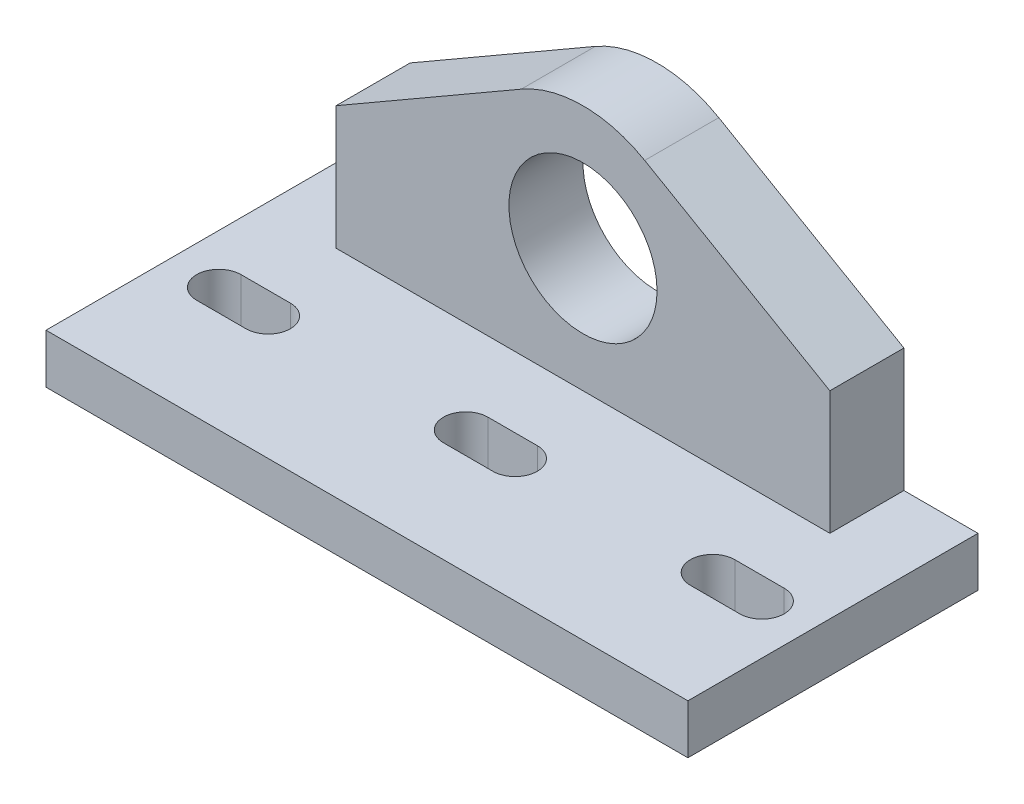
from build123d import *

# Parameters (mm, degrees)
SKETCH_2_W             = 260
SKETCH_2_H             = 117.5
EXTRUDE_1_DEPTH        = 20
CUT_EXTRUDE_1_DEPTH    = 287.017919019
PATTERN_LINEAR_1_COUNT = 3
PATTERN_LINEAR_1_PITCH = 100
SKETCH_4_W             = 200
SKETCH_4_H             = 30
EXTRUDE_2_DEPTH        = 100
SKETCH_5_R             = 30
CUT_EXTRUDE_2_DEPTH    = 300.42653523


with BuildPart() as part:
    # 草图2 → 凸台-拉伸1 (new body)
    with BuildSketch(Plane(origin=(0, 0, 0), x_dir=(1, 0, 0), z_dir=(0, 1, 0))):
        with Locations((130, -58.75)):
            Rectangle(SKETCH_2_W, SKETCH_2_H)
    extrude(amount=EXTRUDE_1_DEPTH)

    # 草图3 → 切除-拉伸1 (cut, through all)
    with BuildSketch(Plane(origin=(0, 20, 0), x_dir=(1, 0, 0), z_dir=(0, 1, 0))):
        with BuildLine():
            Line((20, -58.5), (40, -58.5))
            ThreePointArc((40, -58.5), (49, -67.5), (40, -76.5))
            Line((40, -76.5), (20, -76.5))
            ThreePointArc((20, -76.5), (11, -67.5), (20, -58.5))
        make_face()
    cut_extrude_1 = extrude(amount=-CUT_EXTRUDE_1_DEPTH, mode=Mode.SUBTRACT)

    # 阵列(线性)1: 切除-拉伸1 ×3
    with Locations(*[(i * PATTERN_LINEAR_1_PITCH, 0, 0) for i in range(1, PATTERN_LINEAR_1_COUNT)]):
        add(cut_extrude_1, mode=Mode.SUBTRACT)

    # 草图4 → 凸台-拉伸2 (add)
    with BuildSketch(Plane(origin=(0, 20, 0), x_dir=(1, 0, 0), z_dir=(0, 1, 0))):
        with Locations((130, -15)):
            Rectangle(SKETCH_4_W, SKETCH_4_H)
    extrude(amount=EXTRUDE_2_DEPTH)

    # 草图5 → 切除-拉伸2 (cut, through all)
    with BuildSketch(Plane.XY.offset(30)):
        with Locations((130, 70)):
            Circle(SKETCH_5_R)
        with BuildLine():
            Line((30, 70), (105, 113.301270189))
            ThreePointArc((105, 113.301270189), (130, 120), (155, 113.301270189))
            Line((155, 113.301270189), (230, 70))
            Line((230, 70), (230, 137.29910678))
            Line((230, 137.29910678), (30, 137.29910678))
            Line((30, 137.29910678), (30, 70))
        make_face()
    extrude(amount=-CUT_EXTRUDE_2_DEPTH, mode=Mode.SUBTRACT)


solid = part.part
